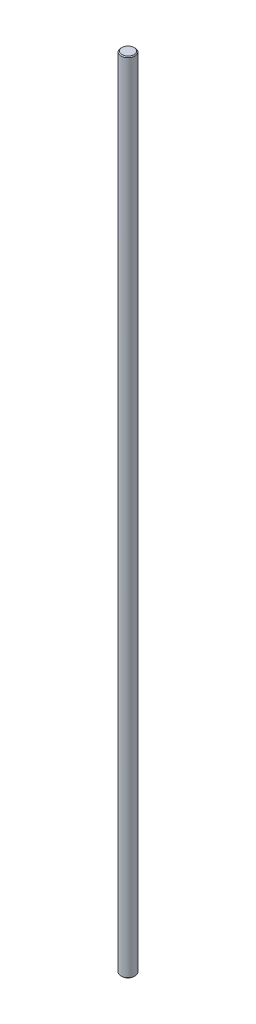
from build123d import *

# Parameters (mm, degrees)
CROQUIS1_R              = 4
SALIENTE_EXTRUIR1_DEPTH = 455
CHAFL_N1_SIZE           = 0.5


with BuildPart() as part:
    # Croquis1 → Saliente-Extruir1 (new body)
    with BuildSketch(Plane(origin=(0, 0, 0), x_dir=(1, 0, 0), z_dir=(0, 1, 0))):
        with Locations(Location((0, 0, 0), (0, 0, 90))):
            Circle(CROQUIS1_R)
    extrude(amount=SALIENTE_EXTRUIR1_DEPTH)

    # Chaflán1
    chafl_n1_edges = [part.edges().sort_by_distance(p)[0] for p in [
        (0, 0, 4),
        (0, 455, 4),
    ]]
    chamfer(chafl_n1_edges, length=CHAFL_N1_SIZE)


solid = part.part
